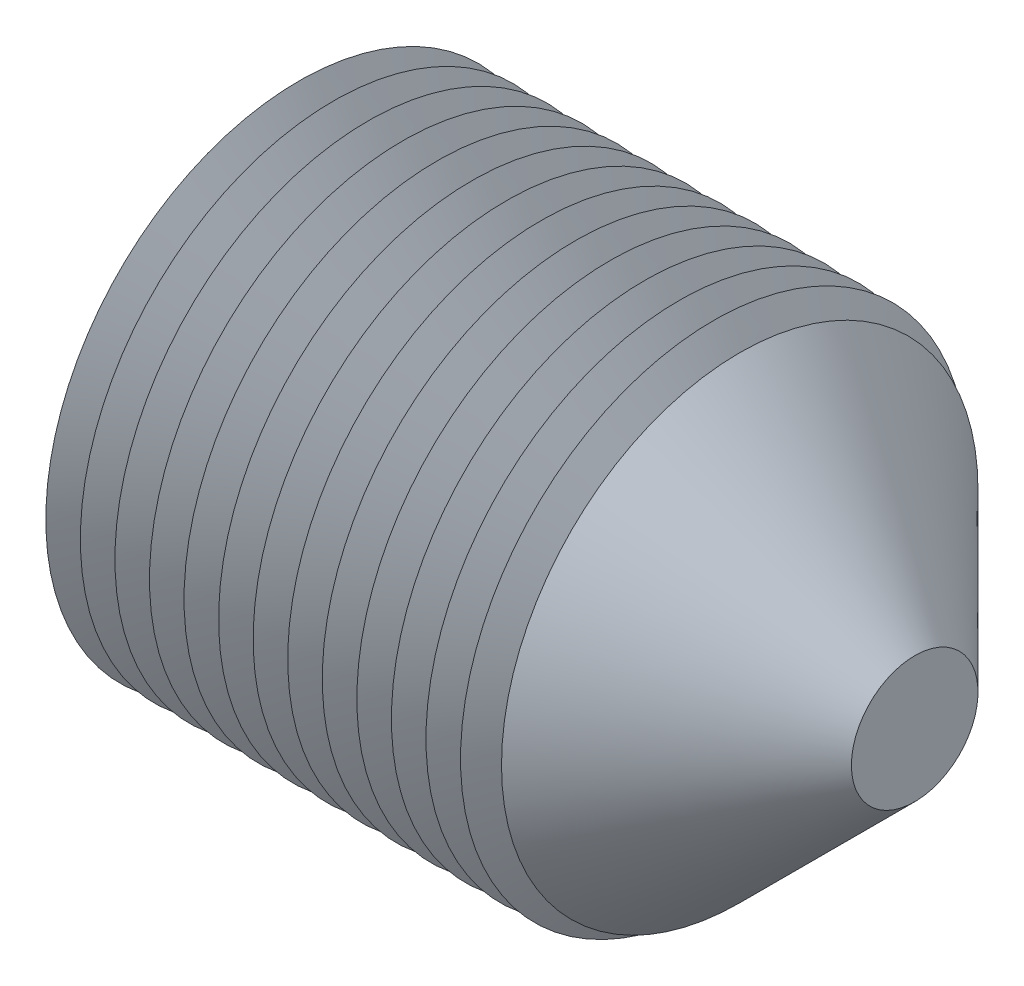
from build123d import *


with BuildPart() as part:
    # 草图1 → 旋转1 (revolve)
    with BuildSketch(Plane.XY, mode=Mode.PRIVATE) as revolve_1_sk:
        Polygon((10, 0), (0, 0), (0, 3.521877004), (0.272997582, 4), (0.545995165, 3.521877004), (0.818992747, 4), (1.091990329, 3.521877004), (1.364987912, 4), (1.637985494, 3.521877004), (1.910983076, 4), (2.183980659, 3.521877004), (2.456978241, 4), (2.729975823, 3.521877004), (3.002973406, 4), (3.275970988, 3.521877004), (3.548968571, 4), (3.821966153, 3.521877004), (4.094963735, 4), (4.367961318, 3.521877004), (4.6409589, 4), (4.913956482, 3.521877004), (5.186954065, 4), (5.459951647, 3.521877004), (5.732949229, 4), (6.005946812, 3.521877004), (6.278944394, 4), (6.551941976, 3.521877004), (6.824939559, 4), (7.097937141, 3.521877004), (7.236117111, 3.763882889), (10, 1), align=None)
    revolve(revolve_1_sk.sketch.rotate(Axis((10, 0, 0), (1, 0, 0)), 270), axis=Axis((10, 0, 0), (1, 0, 0)))


solid = part.part
